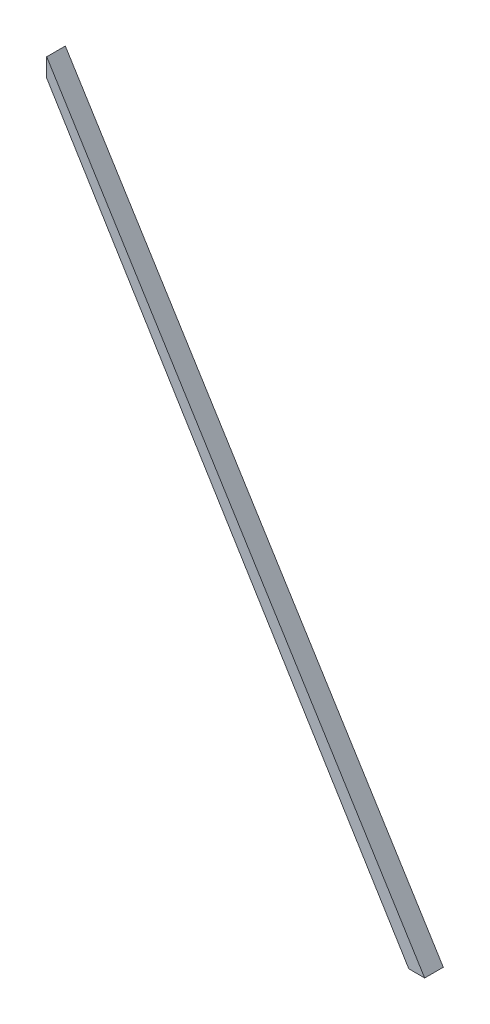
from build123d import *

# Parameters (mm, degrees)
BOSS_EXTRUDE1_DEPTH = 25.4
CUT_EXTRUDE2_DEPTH  = 127
CUT_EXTRUDE3_DEPTH  = 127


with BuildPart() as part:
    # Sketch1 → Boss-Extrude1 (new body)
    with BuildSketch(Plane.XY):
        Polygon((0, 830.58), (515.62, 0), (494.040159482, -13.396659404), (0, 782.421725573), align=None)
    extrude(amount=-BOSS_EXTRUDE1_DEPTH)

    # Sketch2 → Cut-Extrude2 (cut)
    with BuildSketch(Plane.XY):
        Polygon((515.62, 0), (485.723578873, 0), (494.040159482, -13.396659404), align=None)
    extrude(amount=-CUT_EXTRUDE2_DEPTH, mode=Mode.SUBTRACT)

    # Sketch4 → Cut-Extrude3 (cut)
    with BuildSketch(Plane(origin=(0, 0, -25.4), x_dir=(-1, 0, 0), z_dir=(0, 0, -1))):
        Polygon((0, 805.281725573), (-493.978617069, 0), (-485.723578873, 0), (0, 782.421725573), align=None)
    extrude(amount=-CUT_EXTRUDE3_DEPTH, mode=Mode.SUBTRACT)


solid = part.part
